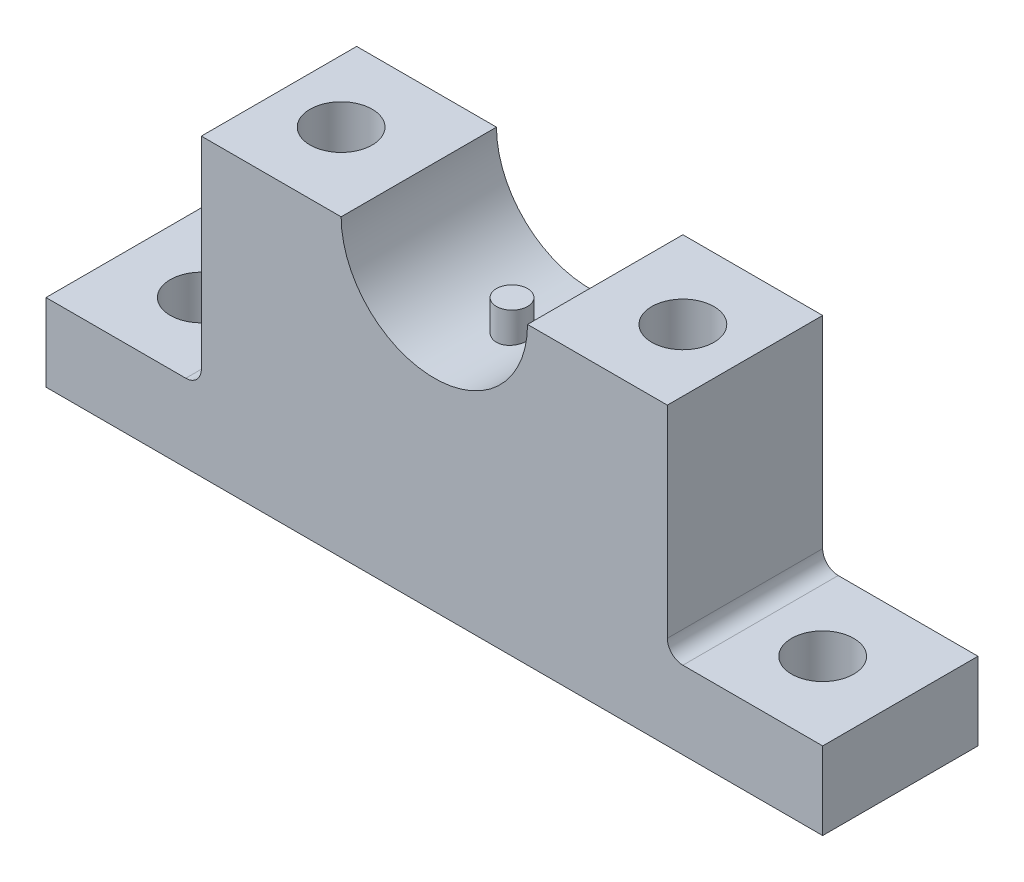
from build123d import *

# Parameters (mm, degrees)
BOSS_EXTRUDE1_DEPTH      = 5
SKETCH2_R                = 2
CUT_EXTRUDE1_DEPTH       = 30.086079144
SKETCH3_R                = 2
CUT_EXTRUDE2_DEPTH       = 6
SKETCH4_R                = 1
CUT_EXTRUDE3_DEPTH       = 8
BOSS_EXTRUDE3_REACH      = 31.58
BOSS_EXTRUDE3_END_RADIUS = 6
SKETCH5_R                = 1


with BuildPart() as part:
    # Sketch1 → Boss-Extrude1 (new, symmetric)
    with BuildSketch(Plane.XY):
        with BuildLine():
            Line((-6, 0), (-15, 0))
            Line((-15, 0), (-15, -13))
            ThreePointArc((-15, -13), (-15.292893219, -13.707106781), (-16, -14))
            Line((-16, -14), (-25, -14))
            Line((-25, -14), (-25, -19))
            Line((-25, -19), (25, -19))
            Line((25, -19), (25, -14))
            Line((25, -14), (16, -14))
            ThreePointArc((16, -14), (15.292893219, -13.707106781), (15, -13))
            Line((15, -13), (15, 0))
            Line((15, 0), (6, 0))
            ThreePointArc((6, 0), (0, -6), (-6, 0))
        make_face()
    extrude(amount=BOSS_EXTRUDE1_DEPTH, both=True)

    # Sketch2 → Cut-Extrude1 (cut, through all)
    with BuildSketch(Plane(origin=(0, -14, 0), x_dir=(1, 0, 0), z_dir=(0, 1, 0))):
        with Locations(Location((-20, 0, 0), (0, 0, 180))):
            Circle(SKETCH2_R)
        with Locations(Location((20, 0, 0), (0, 0, 180))):
            Circle(SKETCH2_R)
    extrude(amount=-CUT_EXTRUDE1_DEPTH, mode=Mode.SUBTRACT)

    # Sketch3 → Cut-Extrude2 (cut)
    with BuildSketch(Plane(origin=(0, 0, 0), x_dir=(1, 0, 0), z_dir=(0, 1, 0))):
        with Locations(Location((-11, 0, 0), (0, 0, 180))):
            Circle(SKETCH3_R)
        with Locations(Location((11, 0, 0), (0, 0, 180))):
            Circle(SKETCH3_R)
    extrude(amount=-CUT_EXTRUDE2_DEPTH, mode=Mode.SUBTRACT)

    # Sketch4 → Cut-Extrude3 (cut)
    with BuildSketch(Plane(origin=(0, 0, 0), x_dir=(1, 0, 0), z_dir=(0, 1, 0))):
        with Locations(Location((0, 0, 0), (0, 0, 180))):
            Circle(SKETCH4_R)
    extrude(amount=-CUT_EXTRUDE3_DEPTH, mode=Mode.SUBTRACT)


with BuildPart() as body_2:
    # Boss-Extrude3: up to this cylinder (the profile starts inside it)
    boss_extrude3_end = Plane(origin=(0, 0, 0), z_dir=(0, 0, -1)) * Cylinder(BOSS_EXTRUDE3_END_RADIUS, 76.16, mode=Mode.PRIVATE)
    # Sketch5 → Boss-Extrude3 (new, up to the surface)
    with BuildSketch(Plane(origin=(0, -4, 0), x_dir=(1, 0, 0), z_dir=(0, 1, 0)), mode=Mode.PRIVATE) as boss_extrude3_sk1:
        with Locations(Location((0, 0, 0), (0, 0, 270))):
            Circle(SKETCH5_R)
    boss_extrude3_tool1 = extrude(boss_extrude3_sk1.sketch, amount=-BOSS_EXTRUDE3_REACH, mode=Mode.PRIVATE) & boss_extrude3_end
    add(boss_extrude3_tool1.solids().sort_by_distance((0, -4, 0))[0])


solid = Compound([part.part, body_2.part])
